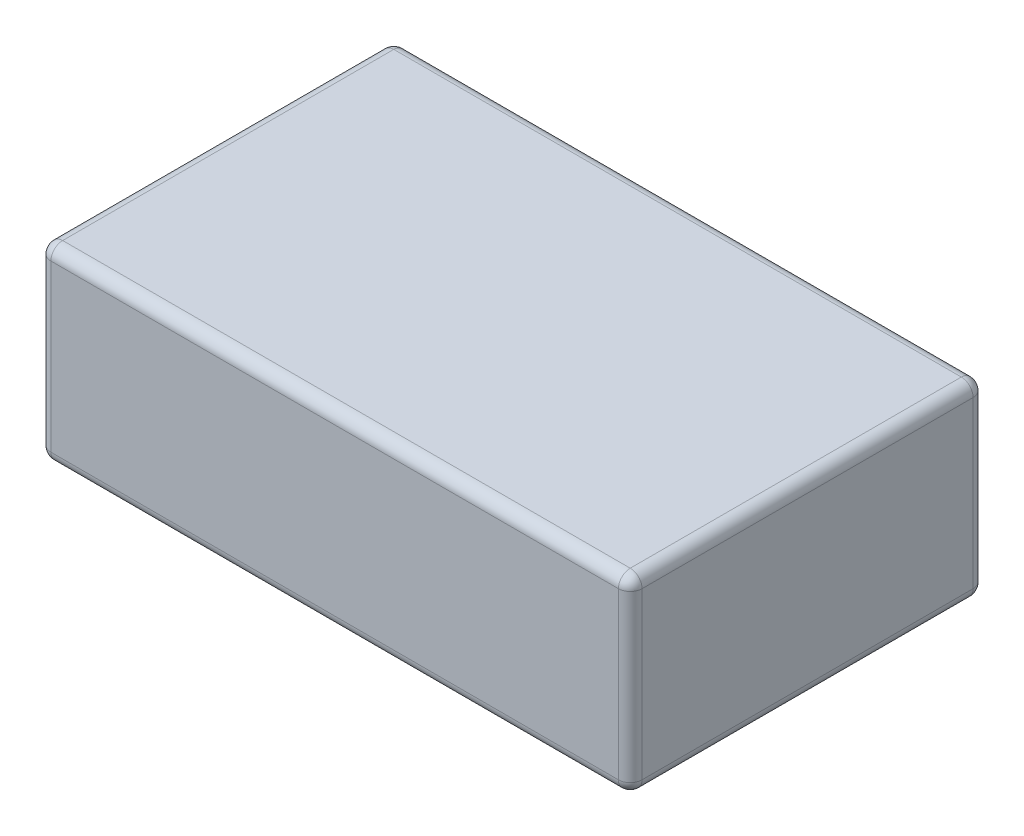
from build123d import *

# Parameters (mm, degrees)
SKETCH1_W           = 30
SKETCH1_H           = 16
BOSS_EXTRUDE1_DEPTH = 50
FILLET1_R           = 1
FILLET2_R           = 1


with BuildPart() as part:
    # Sketch1 → Boss-Extrude1 (new body)
    with BuildSketch(Plane(origin=(0, 0, 0), x_dir=(0, 0, -1), z_dir=(1, 0, 0))):
        Rectangle(SKETCH1_W, SKETCH1_H)
    extrude(amount=-BOSS_EXTRUDE1_DEPTH)

    # Fillet1
    fillet1_edges = [part.edges().sort_by_distance(p)[0] for p in [
        (-25, -8, -15),
        (-25, -8, 15),
        (-25, 8, 15),
        (-25, 8, -15),
    ]]
    fillet(fillet1_edges, radius=FILLET1_R)

    # Fillet2
    fillet2_edges = [part.edges().sort_by_distance(p)[0] for p in [
        (0, -8, 0),
        (-50, -8, 0),
        (0, 0, -15),
        (0, 8, 0),
        (0, 0, 15),
        (0, 7.707106781, 14.707106781),
        (0, 7.707106781, -14.707106781),
        (0, -7.707106781, 14.707106781),
        (0, -7.707106781, -14.707106781),
        (-50, 0, -15),
        (-50, 0, 15),
        (-50, 8, 0),
        (-50, 7.707106781, 14.707106781),
        (-50, 7.707106781, -14.707106781),
        (-50, -7.707106781, 14.707106781),
        (-50, -7.707106781, -14.707106781),
    ]]
    fillet(fillet2_edges, radius=FILLET2_R)


solid = part.part
